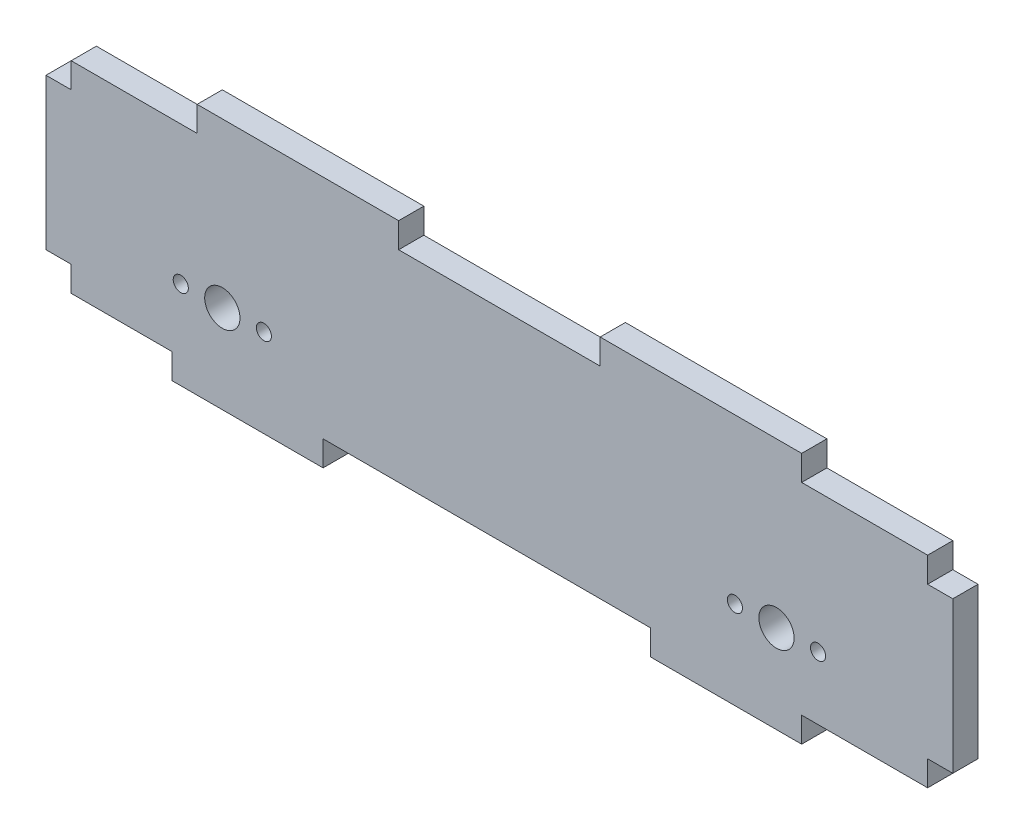
from build123d import *

# Parameters (mm, degrees)
SKETCH1_R           = 1.5
BOSS_EXTRUDE1_DEPTH = 5


with BuildPart() as part:
    # Sketch1 → Boss-Extrude1 (new body)
    # profile 1 of 2: a face of its own
    with BuildSketch(Plane.XY):
        Polygon((-30, -45.891400943), (-30, -50.891400943), (-35, -50.891400943), (-35, -80.891400943), (-30, -80.891400943), (-30, -85.891400943), (-14, -85.891400943), (-10, -85.891400943), (-10, -90.891400943), (20, -90.891400943), (20, -85.891400943), (85, -85.891400943), (110, -85.891400943), (115, -85.891400943), (140, -85.891400943), (140, -80.891400943), (145, -80.891400943), (145, -50.891400943), (140, -50.891400943), (140, -45.891400943), (115, -45.891400943), (115, -40.891400943), (75, -40.891400943), (75, -45.891400943), (35, -45.891400943), (35, -40.891400943), (-5, -40.891400943), (-5, -45.891400943), align=None)
        with Locations((-8.25, -73.391400943)):
            Circle(SKETCH1_R, mode=Mode.SUBTRACT)
        with BuildLine():
            ThreePointArc((3.5, -73.391400943), (2.474873734, -75.866274677), (0, -76.891400943))
            ThreePointArc((0, -76.891400943), (-2.474873734, -75.866274677), (-3.5, -73.391400943))
            ThreePointArc((-3.5, -73.391400943), (0, -69.891400943), (3.5, -73.391400943))
        make_face(mode=Mode.SUBTRACT)
        with BuildLine():
            ThreePointArc((9.75, -73.391400943), (8.25, -74.891400943), (6.75, -73.391400943))
            ThreePointArc((6.75, -73.391400943), (8.25, -71.891400943), (9.75, -73.391400943))
        make_face(mode=Mode.SUBTRACT)
        with Locations((101.75, -73.391400943)):
            Circle(SKETCH1_R, mode=Mode.SUBTRACT)
        with BuildLine():
            ThreePointArc((113.5, -73.391400943), (112.474873734, -75.866274677), (110, -76.891400943))
            ThreePointArc((110, -76.891400943), (107.525126266, -75.866274677), (106.5, -73.391400943))
            ThreePointArc((106.5, -73.391400943), (110, -69.891400943), (113.5, -73.391400943))
        make_face(mode=Mode.SUBTRACT)
        with BuildLine():
            ThreePointArc((119.75, -73.391400943), (118.25, -74.891400943), (116.75, -73.391400943))
            ThreePointArc((116.75, -73.391400943), (118.25, -71.891400943), (119.75, -73.391400943))
        make_face(mode=Mode.SUBTRACT)
    # profile 2 of 2: a face of its own
    with BuildSketch(Plane.XY):
        Polygon((110, -85.891400943), (85, -85.891400943), (85, -90.891400943), (115, -90.891400943), (115, -85.891400943), align=None)
    extrude(amount=BOSS_EXTRUDE1_DEPTH)


solid = part.part
